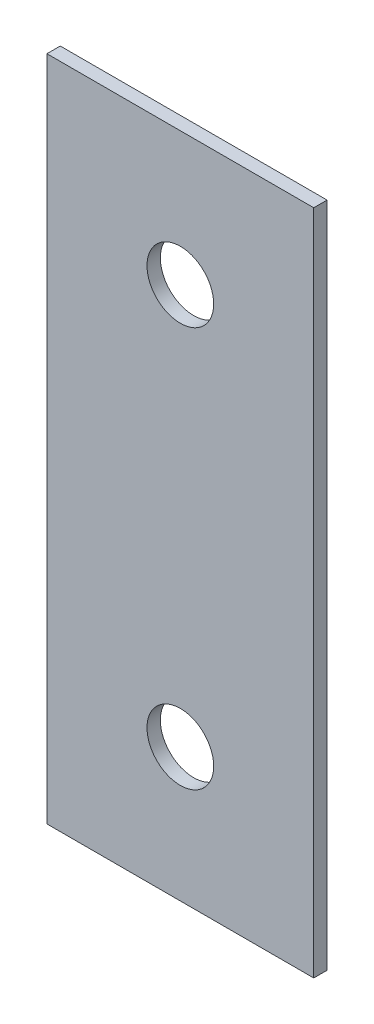
from build123d import *

# Parameters (mm, degrees)
CROQUIS1_W              = 20
CROQUIS1_H              = 50
CROQUIS1_R              = 2.5
SALIENTE_EXTRUIR1_DEPTH = 1


with BuildPart() as part:
    # Croquis1 → Saliente-Extruir1 (new body)
    with BuildSketch(Plane.XY):
        Rectangle(CROQUIS1_W, CROQUIS1_H)
        with Locations((0, 15)):
            Circle(CROQUIS1_R, mode=Mode.SUBTRACT)
        with Locations((0, -15)):
            Circle(CROQUIS1_R, mode=Mode.SUBTRACT)
    extrude(amount=SALIENTE_EXTRUIR1_DEPTH)


solid = part.part
